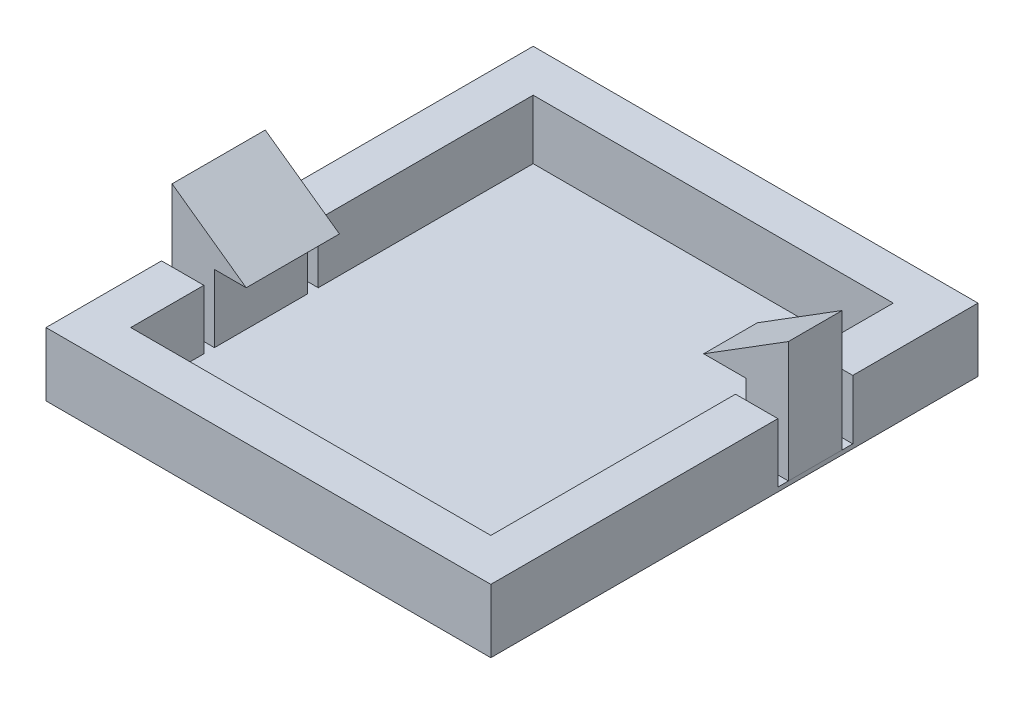
from build123d import *

# Parameters (mm, degrees)
BOSS_EXTRUDE2_DEPTH   = 3
BOSS_EXTRUDE2_2_DEPTH = 3
SKETCH4_W             = 21
SKETCH4_H             = 23
BOSS_EXTRUDE4_DEPTH   = 0.2
SKETCH6_W             = 2
SKETCH6_H             = 4.398930514
SKETCH6_H_2           = 2.53591928
BOSS_EXTRUDE5_DEPTH   = 3.2
BOSS_EXTRUDE6_DEPTH   = 4.398930514
BOSS_EXTRUDE7_DEPTH   = 2.53591928


with BuildPart() as part:
    # Sketch1 → Boss-Extrude2 (new body)
    with BuildSketch(Plane(origin=(0, 0, 0), x_dir=(1, 0, 0), z_dir=(0, 1, 0))):
        Polygon((-10.5, -11.5), (-10.5, -6.046480624), (-8.5, -6.046480624), (-8.5, -9.5), (8.5, -9.5), (8.5, 2.051915147), (10.5, 2.051915147), (10.5, -11.5), align=None)
    extrude(amount=BOSS_EXTRUDE2_DEPTH)



with BuildPart() as body_2:
    # Sketch1 → Boss-Extrude2 2 (new body)
    with BuildSketch(Plane(origin=(0, 0, 0), x_dir=(1, 0, 0), z_dir=(0, 1, 0))):
        Polygon((-8.5, 9.5), (8.5, 9.5), (8.5, 5.587834427), (10.5, 5.587834427), (10.5, 11.5), (-10.5, 11.5), (-10.5, -0.64755011), (-8.5, -0.64755011), align=None)
    extrude(amount=BOSS_EXTRUDE2_2_DEPTH)


with BuildPart() as part_1:
    add(part.part)

    add(body_2.part)  # Boss-Extrude4 merges body 2
    # Sketch4 → Boss-Extrude4 (add)
    with BuildSketch(Plane(origin=(0, 0, 0), x_dir=(1, 0, 0), z_dir=(0, 1, 0))):
        Rectangle(SKETCH4_W, SKETCH4_H)
    extrude(amount=BOSS_EXTRUDE4_DEPTH)

    # Sketch6 → Boss-Extrude5 (add)
    with BuildSketch(Plane(origin=(0, 0.2, 0), x_dir=(1, 0, 0), z_dir=(0, 1, 0))):
        with Locations((-9.501045586, -3.347015367)):
            Rectangle(SKETCH6_W, SKETCH6_H)
        with Locations((9.496513771, 3.819874787)):
            Rectangle(SKETCH6_W, SKETCH6_H_2)
    extrude(amount=BOSS_EXTRUDE5_DEPTH)

    # Sketch7 → Boss-Extrude6 (add)
    with BuildSketch(Plane.XY.offset(5.546480624)):
        Polygon((-10.501045586, 3.4), (-10.501045586, 5.9), (-7.001045586, 3.4), align=None)
    extrude(amount=-BOSS_EXTRUDE6_DEPTH)

    # Sketch8 → Boss-Extrude7 (add)
    with BuildSketch(Plane.XY.offset(-2.551915147)):
        Polygon((10.496513771, 3.4), (10.496513771, 5.9), (6.496513771, 3.4), align=None)
    extrude(amount=-BOSS_EXTRUDE7_DEPTH)


solid = part_1.part
